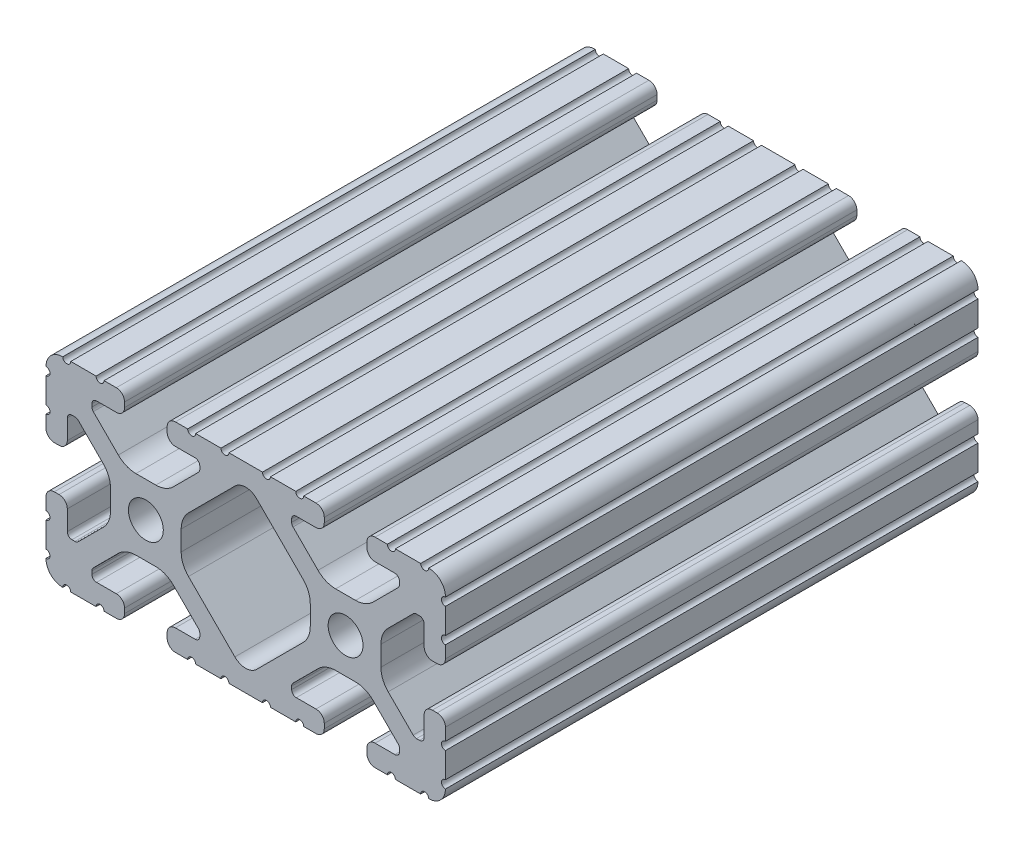
from build123d import *

# Parameters (mm, degrees)
SKETCH1_R           = 3.3274
BOSS_EXTRUDE1_DEPTH = 101.6


with BuildPart() as part:
    # Sketch1 → Boss-Extrude1 (new body)
    with BuildSketch(Plane.XY):
        with BuildLine():
            Line((38.1, -14.3256), (38.1, -9.4996))
            ThreePointArc((38.1, -9.4996), (37.338, -8.7376), (38.1, -7.9756))
            Line((38.1, -7.9756), (38.1, -5.6388))
            ThreePointArc((38.1, -5.6388), (37.638751759, -4.525248241), (36.5252, -4.064))
            Line((36.5252, -4.064), (35.6108, -4.064))
            ThreePointArc((35.6108, -4.064), (34.497248241, -4.525248241), (34.036, -5.6388))
            Line((34.036, -5.6388), (34.036, -9.398))
            ThreePointArc((34.036, -9.398), (33.775617928, -10.026617928), (33.147, -10.287))
            Line((33.147, -10.287), (32.578918, -10.287))
            ThreePointArc((32.578918, -10.287), (32.238712428, -10.219328904), (31.950300071, -10.026617928))
            Line((31.950300071, -10.026617928), (27.179198975, -5.255516832))
            ThreePointArc((27.179198975, -5.255516832), (26.14957176, -3.71457081), (25.788014764, -1.896901043))
            Line((25.788014764, -1.896901043), (25.788014764, 1.896901043))
            ThreePointArc((25.788014764, 1.896901043), (26.14957176, 3.71457081), (27.179198975, 5.255516832))
            Line((27.179198975, 5.255516832), (31.950300071, 10.026617928))
            ThreePointArc((31.950300071, 10.026617928), (32.238712428, 10.219328904), (32.578918, 10.287))
            Line((32.578918, 10.287), (33.147, 10.287))
            ThreePointArc((33.147, 10.287), (33.775617928, 10.026617928), (34.036, 9.398))
            Line((34.036, 9.398), (34.036, 5.6388))
            ThreePointArc((34.036, 5.6388), (34.497248241, 4.525248241), (35.6108, 4.064))
            Line((35.6108, 4.064), (36.5252, 4.064))
            ThreePointArc((36.5252, 4.064), (37.638751759, 4.525248241), (38.1, 5.6388))
            Line((38.1, 5.6388), (38.1, 7.9756))
            ThreePointArc((38.1, 7.9756), (37.338, 8.7376), (38.1, 9.4996))
            Line((38.1, 9.4996), (38.1, 14.3256))
            ThreePointArc((38.1, 14.3256), (37.338, 15.0876), (38.1, 15.8496))
            Line((38.1, 15.8496), (38.1, 15.875))
            ThreePointArc((38.1, 15.875), (37.17006403, 18.12006403), (34.925, 19.05))
            Line((34.925, 19.05), (34.8996, 19.05))
            ThreePointArc((34.8996, 19.05), (34.1376, 18.288), (33.3756, 19.05))
            Line((33.3756, 19.05), (28.5496, 19.05))
            ThreePointArc((28.5496, 19.05), (27.7876, 18.288), (27.0256, 19.05))
            Line((27.0256, 19.05), (24.6888, 19.05))
            ThreePointArc((24.6888, 19.05), (23.575248241, 18.588751759), (23.114, 17.4752))
            Line((23.114, 17.4752), (23.114, 16.5608))
            ThreePointArc((23.114, 16.5608), (23.575248241, 15.447248241), (24.6888, 14.986))
            Line((24.6888, 14.986), (28.448, 14.986))
            ThreePointArc((28.448, 14.986), (29.076617928, 14.725617928), (29.337, 14.097))
            Line((29.337, 14.097), (29.337, 13.528918))
            ThreePointArc((29.337, 13.528918), (29.269328904, 13.188712428), (29.076617928, 12.900300071))
            Line((29.076617928, 12.900300071), (24.305516832, 8.129198975))
            ThreePointArc((24.305516832, 8.129198975), (22.76457081, 7.09957176), (20.946901043, 6.738014764))
            Line((20.946901043, 6.738014764), (17.153098957, 6.738014764))
            ThreePointArc((17.153098957, 6.738014764), (15.33542919, 7.09957176), (13.794483168, 8.129198975))
            Line((13.794483168, 8.129198975), (9.023382072, 12.900300071))
            ThreePointArc((9.023382072, 12.900300071), (8.830671096, 13.188712428), (8.763, 13.528918))
            Line((8.763, 13.528918), (8.763, 14.097))
            ThreePointArc((8.763, 14.097), (9.023382072, 14.725617928), (9.652, 14.986))
            Line((9.652, 14.986), (13.4112, 14.986))
            ThreePointArc((13.4112, 14.986), (14.524751759, 15.447248241), (14.986, 16.5608))
            Line((14.986, 16.5608), (14.986, 17.4752))
            ThreePointArc((14.986, 17.4752), (14.524751759, 18.588751759), (13.4112, 19.05))
            Line((13.4112, 19.05), (11.0744, 19.05))
            ThreePointArc((11.0744, 19.05), (10.3124, 18.288), (9.5504, 19.05))
            Line((9.5504, 19.05), (4.7244, 19.05))
            ThreePointArc((4.7244, 19.05), (3.9624, 18.288), (3.2004, 19.05))
            Line((3.2004, 19.05), (-3.2004, 19.05))
            ThreePointArc((-3.2004, 19.05), (-3.9624, 18.288), (-4.7244, 19.05))
            Line((-4.7244, 19.05), (-9.5504, 19.05))
            ThreePointArc((-9.5504, 19.05), (-10.3124, 18.288), (-11.0744, 19.05))
            Line((-11.0744, 19.05), (-13.4112, 19.05))
            ThreePointArc((-13.4112, 19.05), (-14.524751759, 18.588751759), (-14.986, 17.4752))
            Line((-14.986, 17.4752), (-14.986, 16.5608))
            ThreePointArc((-14.986, 16.5608), (-14.524751759, 15.447248241), (-13.4112, 14.986))
            Line((-13.4112, 14.986), (-9.652, 14.986))
            ThreePointArc((-9.652, 14.986), (-9.023382072, 14.725617928), (-8.763, 14.097))
            Line((-8.763, 14.097), (-8.763, 13.528918))
            ThreePointArc((-8.763, 13.528918), (-8.830671096, 13.188712428), (-9.023382072, 12.900300071))
            Line((-9.023382072, 12.900300071), (-13.794483168, 8.129198975))
            ThreePointArc((-13.794483168, 8.129198975), (-15.33542919, 7.09957176), (-17.153098957, 6.738014764))
            Line((-17.153098957, 6.738014764), (-20.946901043, 6.738014764))
            ThreePointArc((-20.946901043, 6.738014764), (-22.76457081, 7.09957176), (-24.305516832, 8.129198975))
            Line((-24.305516832, 8.129198975), (-29.076617928, 12.900300071))
            ThreePointArc((-29.076617928, 12.900300071), (-29.269328904, 13.188712428), (-29.337, 13.528918))
            Line((-29.337, 13.528918), (-29.337, 14.097))
            ThreePointArc((-29.337, 14.097), (-29.076617928, 14.725617928), (-28.448, 14.986))
            Line((-28.448, 14.986), (-24.6888, 14.986))
            ThreePointArc((-24.6888, 14.986), (-23.575248241, 15.447248241), (-23.114, 16.5608))
            Line((-23.114, 16.5608), (-23.114, 17.4752))
            ThreePointArc((-23.114, 17.4752), (-23.575248241, 18.588751759), (-24.6888, 19.05))
            Line((-24.6888, 19.05), (-27.0256, 19.05))
            ThreePointArc((-27.0256, 19.05), (-27.7876, 18.288), (-28.5496, 19.05))
            Line((-28.5496, 19.05), (-33.3756, 19.05))
            ThreePointArc((-33.3756, 19.05), (-34.1376, 18.288), (-34.8996, 19.05))
            Line((-34.8996, 19.05), (-34.925, 19.05))
            ThreePointArc((-34.925, 19.05), (-37.17006403, 18.12006403), (-38.1, 15.875))
            Line((-38.1, 15.875), (-38.1, 15.8496))
            ThreePointArc((-38.1, 15.8496), (-37.338, 15.0876), (-38.1, 14.3256))
            Line((-38.1, 14.3256), (-38.1, 9.4996))
            ThreePointArc((-38.1, 9.4996), (-37.338, 8.7376), (-38.1, 7.9756))
            Line((-38.1, 7.9756), (-38.1, 5.6388))
            ThreePointArc((-38.1, 5.6388), (-37.638751759, 4.525248241), (-36.5252, 4.064))
            Line((-36.5252, 4.064), (-35.6108, 4.064))
            ThreePointArc((-35.6108, 4.064), (-34.497248241, 4.525248241), (-34.036, 5.6388))
            Line((-34.036, 5.6388), (-34.036, 9.398))
            ThreePointArc((-34.036, 9.398), (-33.775617928, 10.026617928), (-33.147, 10.287))
            Line((-33.147, 10.287), (-32.578918, 10.287))
            ThreePointArc((-32.578918, 10.287), (-32.238712428, 10.219328904), (-31.950300071, 10.026617928))
            Line((-31.950300071, 10.026617928), (-27.179198975, 5.255516832))
            ThreePointArc((-27.179198975, 5.255516832), (-26.14957176, 3.71457081), (-25.788014764, 1.896901043))
            Line((-25.788014764, 1.896901043), (-25.788014764, -1.896901043))
            ThreePointArc((-25.788014764, -1.896901043), (-26.14957176, -3.71457081), (-27.179198975, -5.255516832))
            Line((-27.179198975, -5.255516832), (-31.950300071, -10.026617928))
            ThreePointArc((-31.950300071, -10.026617928), (-32.238712428, -10.219328904), (-32.578918, -10.287))
            Line((-32.578918, -10.287), (-33.147, -10.287))
            ThreePointArc((-33.147, -10.287), (-33.775617928, -10.026617928), (-34.036, -9.398))
            Line((-34.036, -9.398), (-34.036, -5.6388))
            ThreePointArc((-34.036, -5.6388), (-34.497248241, -4.525248241), (-35.6108, -4.064))
            Line((-35.6108, -4.064), (-36.5252, -4.064))
            ThreePointArc((-36.5252, -4.064), (-37.638751759, -4.525248241), (-38.1, -5.6388))
            Line((-38.1, -5.6388), (-38.1, -7.9756))
            ThreePointArc((-38.1, -7.9756), (-37.338, -8.7376), (-38.1, -9.4996))
            Line((-38.1, -9.4996), (-38.1, -14.3256))
            ThreePointArc((-38.1, -14.3256), (-37.338, -15.0876), (-38.1, -15.8496))
            Line((-38.1, -15.8496), (-38.1, -15.875))
            ThreePointArc((-38.1, -15.875), (-37.17006403, -18.12006403), (-34.925, -19.05))
            Line((-34.925, -19.05), (-34.8996, -19.05))
            ThreePointArc((-34.8996, -19.05), (-34.1376, -18.288), (-33.3756, -19.05))
            Line((-33.3756, -19.05), (-28.5496, -19.05))
            ThreePointArc((-28.5496, -19.05), (-27.7876, -18.288), (-27.0256, -19.05))
            Line((-27.0256, -19.05), (-24.6888, -19.05))
            ThreePointArc((-24.6888, -19.05), (-23.575248241, -18.588751759), (-23.114, -17.4752))
            Line((-23.114, -17.4752), (-23.114, -16.5608))
            ThreePointArc((-23.114, -16.5608), (-23.575248241, -15.447248241), (-24.6888, -14.986))
            Line((-24.6888, -14.986), (-28.448, -14.986))
            ThreePointArc((-28.448, -14.986), (-29.076617928, -14.725617928), (-29.337, -14.097))
            Line((-29.337, -14.097), (-29.337, -13.528918))
            ThreePointArc((-29.337, -13.528918), (-29.269328904, -13.188712428), (-29.076617928, -12.900300071))
            Line((-29.076617928, -12.900300071), (-24.305516832, -8.129198975))
            ThreePointArc((-24.305516832, -8.129198975), (-22.76457081, -7.09957176), (-20.946901043, -6.738014764))
            Line((-20.946901043, -6.738014764), (-17.153098957, -6.738014764))
            ThreePointArc((-17.153098957, -6.738014764), (-15.33542919, -7.09957176), (-13.794483168, -8.129198975))
            Line((-13.794483168, -8.129198975), (-9.023382072, -12.900300071))
            ThreePointArc((-9.023382072, -12.900300071), (-8.830671096, -13.188712428), (-8.763, -13.528918))
            Line((-8.763, -13.528918), (-8.763, -14.097))
            ThreePointArc((-8.763, -14.097), (-9.023382072, -14.725617928), (-9.652, -14.986))
            Line((-9.652, -14.986), (-13.4112, -14.986))
            ThreePointArc((-13.4112, -14.986), (-14.524751759, -15.447248241), (-14.986, -16.5608))
            Line((-14.986, -16.5608), (-14.986, -17.4752))
            ThreePointArc((-14.986, -17.4752), (-14.524751759, -18.588751759), (-13.4112, -19.05))
            Line((-13.4112, -19.05), (-11.0744, -19.05))
            ThreePointArc((-11.0744, -19.05), (-10.3124, -18.288), (-9.5504, -19.05))
            Line((-9.5504, -19.05), (-4.7244, -19.05))
            ThreePointArc((-4.7244, -19.05), (-3.9624, -18.288), (-3.2004, -19.05))
            Line((-3.2004, -19.05), (3.2004, -19.05))
            ThreePointArc((3.2004, -19.05), (3.9624, -18.288), (4.7244, -19.05))
            Line((4.7244, -19.05), (9.5504, -19.05))
            ThreePointArc((9.5504, -19.05), (10.3124, -18.288), (11.0744, -19.05))
            Line((11.0744, -19.05), (13.4112, -19.05))
            ThreePointArc((13.4112, -19.05), (14.524751759, -18.588751759), (14.986, -17.4752))
            Line((14.986, -17.4752), (14.986, -16.5608))
            ThreePointArc((14.986, -16.5608), (14.524751759, -15.447248241), (13.4112, -14.986))
            Line((13.4112, -14.986), (9.652, -14.986))
            ThreePointArc((9.652, -14.986), (9.023382072, -14.725617928), (8.763, -14.097))
            Line((8.763, -14.097), (8.763, -13.528918))
            ThreePointArc((8.763, -13.528918), (8.830671096, -13.188712428), (9.023382072, -12.900300071))
            Line((9.023382072, -12.900300071), (13.794483168, -8.129198975))
            ThreePointArc((13.794483168, -8.129198975), (15.33542919, -7.09957176), (17.153098957, -6.738014764))
            Line((17.153098957, -6.738014764), (20.946901043, -6.738014764))
            ThreePointArc((20.946901043, -6.738014764), (22.76457081, -7.09957176), (24.305516832, -8.129198975))
            Line((24.305516832, -8.129198975), (29.076617928, -12.900300071))
            ThreePointArc((29.076617928, -12.900300071), (29.269328904, -13.188712428), (29.337, -13.528918))
            Line((29.337, -13.528918), (29.337, -14.097))
            ThreePointArc((29.337, -14.097), (29.076617928, -14.725617928), (28.448, -14.986))
            Line((28.448, -14.986), (24.6888, -14.986))
            ThreePointArc((24.6888, -14.986), (23.575248241, -15.447248241), (23.114, -16.5608))
            Line((23.114, -16.5608), (23.114, -17.4752))
            ThreePointArc((23.114, -17.4752), (23.575248241, -18.588751759), (24.6888, -19.05))
            Line((24.6888, -19.05), (27.0256, -19.05))
            ThreePointArc((27.0256, -19.05), (27.7876, -18.288), (28.5496, -19.05))
            Line((28.5496, -19.05), (33.3756, -19.05))
            ThreePointArc((33.3756, -19.05), (34.1376, -18.288), (34.8996, -19.05))
            Line((34.8996, -19.05), (34.925, -19.05))
            ThreePointArc((34.925, -19.05), (37.17006403, -18.12006403), (38.1, -15.875))
            Line((38.1, -15.875), (38.1, -15.8496))
            ThreePointArc((38.1, -15.8496), (37.338, -15.0876), (38.1, -14.3256))
        make_face()
        with Locations((19.05, 0)):
            Circle(SKETCH1_R, mode=Mode.SUBTRACT)
        with Locations((-19.05, 0)):
            Circle(SKETCH1_R, mode=Mode.SUBTRACT)
        with BuildLine():
            Line((-12.31198542, -1.896901043), (-12.31198542, 1.896901043))
            ThreePointArc((-12.31198542, 1.896901043), (-11.950428424, 3.71457081), (-10.920801209, 5.255516832))
            Line((-10.920801209, 5.255516832), (-2.065458908, 14.110859133))
            ThreePointArc((-2.065458908, 14.110859133), (0, 14.966400226), (2.065458908, 14.110859133))
            Line((2.065458908, 14.110859133), (10.920801209, 5.255516832))
            ThreePointArc((10.920801209, 5.255516832), (11.950428424, 3.71457081), (12.31198542, 1.896901043))
            Line((12.31198542, 1.896901043), (12.31198542, -1.896901043))
            ThreePointArc((12.31198542, -1.896901043), (11.950428424, -3.71457081), (10.920801209, -5.255516832))
            Line((10.920801209, -5.255516832), (2.065458908, -14.110859133))
            ThreePointArc((2.065458908, -14.110859133), (0, -14.966400226), (-2.065458908, -14.110859133))
            Line((-2.065458908, -14.110859133), (-10.920801209, -5.255516832))
            ThreePointArc((-10.920801209, -5.255516832), (-11.950428424, -3.71457081), (-12.31198542, -1.896901043))
        make_face(mode=Mode.SUBTRACT)
    extrude(amount=BOSS_EXTRUDE1_DEPTH)


solid = part.part
